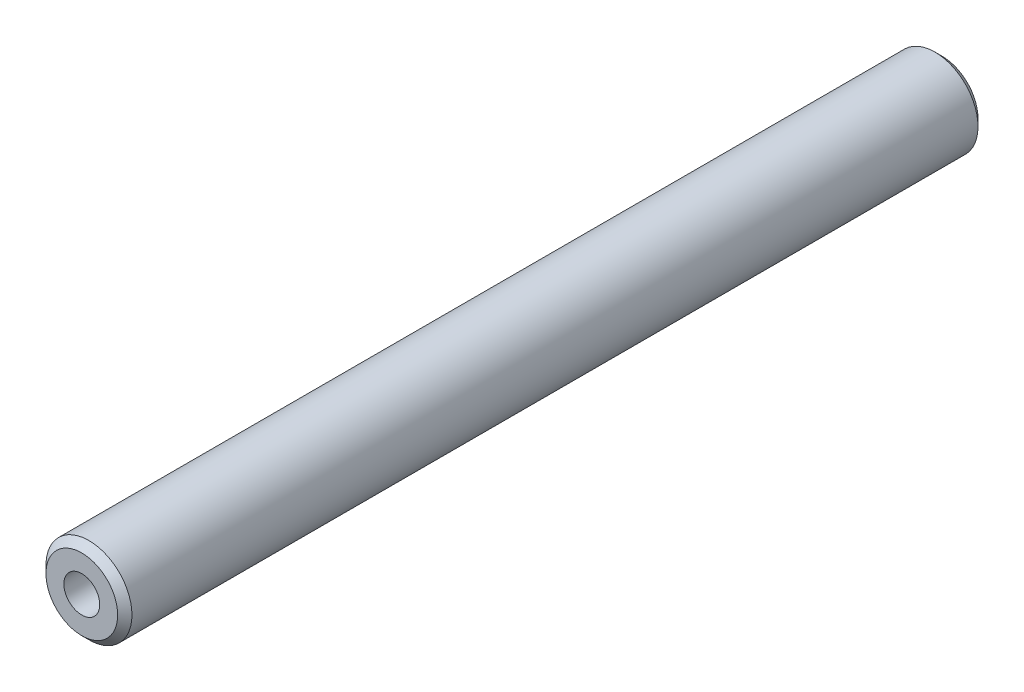
from build123d import *

# Parameters (mm, degrees)
SKETCH_2_R      = 3
EXTRUDE_1_DEPTH = 30
CHAMFER_1_SIZE  = 0.5


with BuildPart() as part:
    # ｽｹｯﾁ2 → ﾎﾞｽ - 押し出し1 (new, symmetric)
    with BuildSketch(Plane.XY):
        Circle(SKETCH_2_R)
    extrude(amount=EXTRUDE_1_DEPTH, both=True)

    # ｽｹｯﾁ4 → M3 ねじ穴1 (revolve, cut)
    with BuildSketch(Plane(origin=(0, 0, 30), x_dir=(0, -1, 0), z_dir=(1, 0, 0))):
        Polygon((0, 0), (0, 9.251075774), (1.25, 8.5), (1.25, 0), align=None)
    hole_wizard_m3_1 = revolve(axis=Axis((0, 0, 36.35), (0, 0, -1)), mode=Mode.SUBTRACT)

    # ﾐﾗｰ1: M3 ねじ穴1 across plane
    add(hole_wizard_m3_1.mirror(Plane.XY), mode=Mode.SUBTRACT)

    # 面取り1
    chamfer_1_edges = [part.edges().sort_by_distance(p)[0] for p in [
        (-3, 0, -30),
        (-3, 0, 30),
    ]]
    chamfer(chamfer_1_edges, length=CHAMFER_1_SIZE)


solid = part.part
